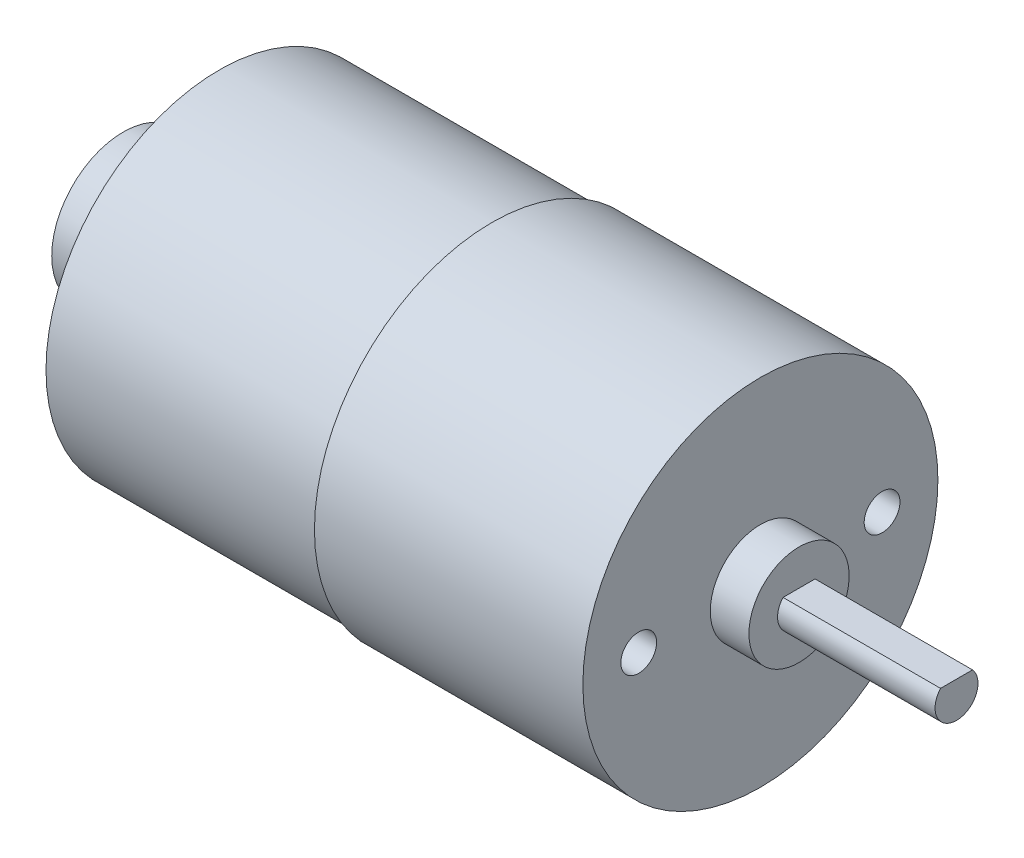
from build123d import *

# Parameters (mm, degrees)
SKETCH_2_R             = 5
EXTRUDE_1_DEPTH        = 6.7
HOLE_WIZARD_M3_1_D     = 2.5
HOLE_WIZARD_M3_1_DEPTH = 5
CUT_EXTRUDE_1_DEPTH    = 11


with BuildPart() as part:
    # 草图1 → 旋转1 (revolve)
    with BuildSketch(Plane.XY, mode=Mode.PRIVATE) as revolve_1_sk:
        Polygon((0, 0), (0, 12.1), (19.05, 12.1), (19.05, 12.4), (37.8, 12.4), (37.8, 3.5), (40.5, 3.5), (40.5, 1.5), (51.5, 1.5), (51.5, 0), align=None)
    revolve(revolve_1_sk.sketch.rotate(Axis((0, 0, 0), (1, 0, 0)), 90), axis=Axis((0, 0, 0), (1, 0, 0)))

    # 草图2 → 凸台-拉伸1 (add)
    with BuildSketch(Plane.ZY):
        Circle(SKETCH_2_R)
    extrude(amount=EXTRUDE_1_DEPTH)

    # M3 螺纹孔的螺纹孔钻头1
    with Locations(Plane(origin=(37.8, 0, 0), x_dir=(0, 0, -1), z_dir=(1, 0, 0))):
        with Locations((-8.5, 0)):
            hole_wizard_m3_1 = Hole(HOLE_WIZARD_M3_1_D / 2, depth=HOLE_WIZARD_M3_1_DEPTH)

    # 镜向1: M3 螺纹孔的螺纹孔钻头1 across plane
    add(hole_wizard_m3_1.mirror(Plane.XY), mode=Mode.SUBTRACT)

    # 草图7 → 切除-拉伸1 (cut)
    with BuildSketch(Plane(origin=(51.5, 0, 0), x_dir=(0, 0, -1), z_dir=(1, 0, 0))):
        with BuildLine():
            Line((-1.118033989, 1), (1.118033989, 1))
            ThreePointArc((1.118033989, 1), (0, 1.5), (-1.118033989, 1))
        make_face()
    extrude(amount=-CUT_EXTRUDE_1_DEPTH, mode=Mode.SUBTRACT)


solid = part.part
